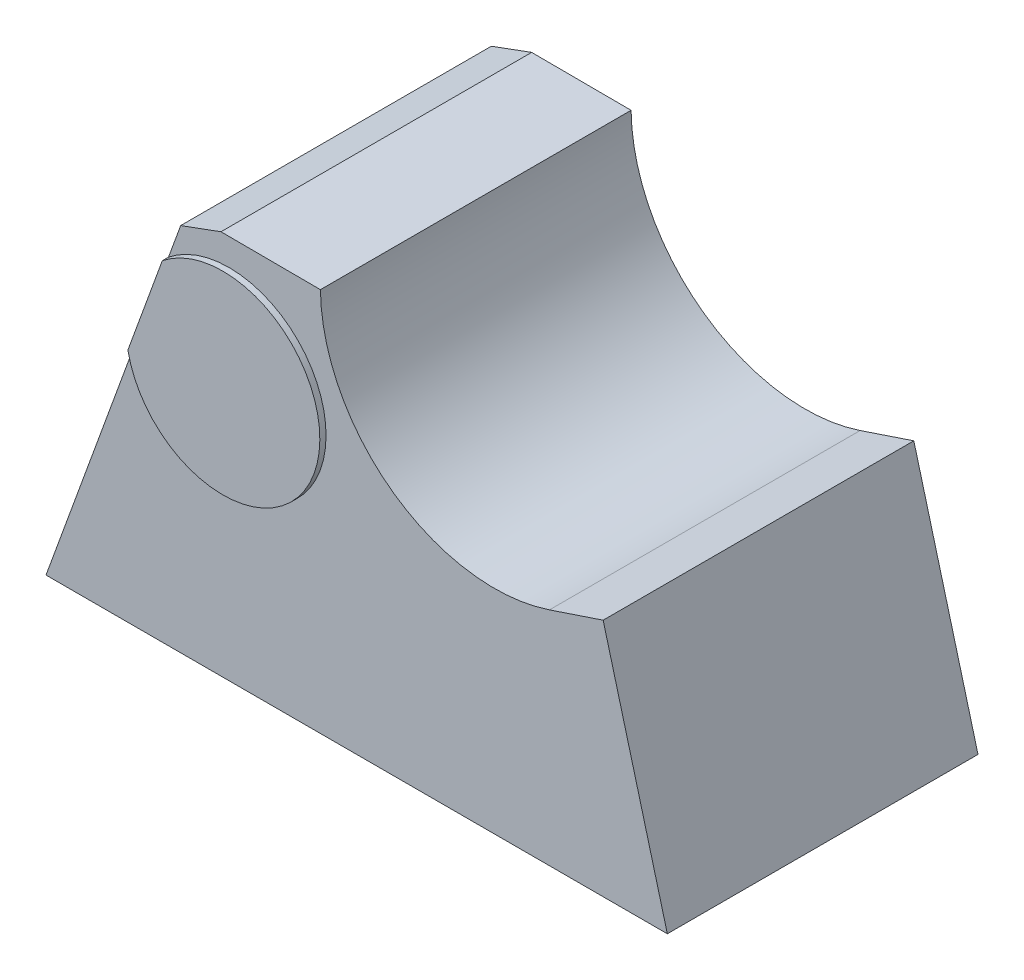
from build123d import *

# Parameters (mm, degrees)
BOSS_EXTRUDE1_DEPTH     = 250
SKETCH3_R               = 78
BOSS_EXTRUDE2_DEPTH     = 5
SKETCH4_W               = 20
SKETCH4_H               = 50
BOSS_EXTRUDE3_DEPTH     = 8
SKETCH5_R               = 56
BOSS_EXTRUDE4_DEPTH     = 5
SKETCH6_W               = 140.323042475
SKETCH6_H               = 120
BOSS_EXTRUDE5_DEPTH     = 8
CUT_EXTRUDE1_DEPTH      = 619.973343529
CUT_EXTRUDE1_DEPTH_BACK = 619.973343529
CUT_EXTRUDE2_DEPTH      = 619.973343529
CUT_EXTRUDE2_DEPTH_BACK = 619.973343529


with BuildPart() as part:
    # Sketch2 → Boss-Extrude1 (new body)
    with BuildSketch(Plane.XY):
        with BuildLine():
            Line((0, 0), (0, -258))
            Line((0, -258), (500, -258))
            Line((500, -258), (500, -48))
            Line((500, -48), (405.149093968, -79.675))
            ThreePointArc((405.149093968, -79.675), (279.704330156, -61.001338916), (220.815553876, 51.325))
            Line((220.815553876, 51.325), (140.816338804, 51.679383953))
            Line((140.816338804, 51.679383953), (0, 0))
        make_face()
    extrude(amount=-BOSS_EXTRUDE1_DEPTH)

    # Sketch3 → Boss-Extrude2 (add)
    with BuildSketch(Plane.XY):
        with Locations(Location((147.365575326, -47.984465758, 0), (0, 0, 180))):
            Circle(SKETCH3_R)
    extrude(amount=BOSS_EXTRUDE2_DEPTH)

    # Sketch4 → Boss-Extrude3 (add)
    with BuildSketch(Plane.XY):
        with Locations((33.562653109, -47.515690105)):
            Rectangle(SKETCH4_W, SKETCH4_H)
    extrude(amount=BOSS_EXTRUDE3_DEPTH)

    # Sketch5 → Boss-Extrude4 (add)
    with BuildSketch(Plane(origin=(0, 0, -250), x_dir=(-1, 0, 0), z_dir=(0, 0, -1))):
        with Locations((-147.365575326, -47.984465758)):
            Circle(SKETCH5_R)
    extrude(amount=BOSS_EXTRUDE4_DEPTH)

    # Sketch6 → Boss-Extrude5 (add)
    with BuildSketch(Plane(origin=(0, 0, -250), x_dir=(-1, 0, 0), z_dir=(0, 0, -1))):
        with Locations((-147.365575326, -182.265748938)):
            Rectangle(SKETCH6_W, SKETCH6_H)
    extrude(amount=BOSS_EXTRUDE5_DEPTH)

    # Sketch8 → Cut-Extrude1 (cut, two sides: drawn at the far end of the back side and taken through both)
    with BuildSketch(Plane(origin=(0, 0, -250), x_dir=(-1, 0, 0), z_dir=(0, 0, -1)).offset(-CUT_EXTRUDE1_DEPTH_BACK)):
        Polygon((-500, -78.40253223), (-500, -258), (-457.637340455, -99.900402235), (-448.352137529, -65.247553157), (-500, -48), align=None)
    extrude(amount=CUT_EXTRUDE1_DEPTH + CUT_EXTRUDE1_DEPTH_BACK, mode=Mode.SUBTRACT)

    # Sketch9 → Cut-Extrude2 (cut, two sides: drawn at the far end of the back side and taken through both)
    with BuildSketch(Plane(origin=(0, 0, -250), x_dir=(-1, 0, 0), z_dir=(0, 0, -1)).offset(-CUT_EXTRUDE2_DEPTH_BACK)):
        Polygon((-65.451377524, -78.173818182), (0, -258), (0, -19.248703784), (0, 0), (-108.38155171, 39.77586601), align=None)
    extrude(amount=CUT_EXTRUDE2_DEPTH + CUT_EXTRUDE2_DEPTH_BACK, mode=Mode.SUBTRACT)


solid = part.part
